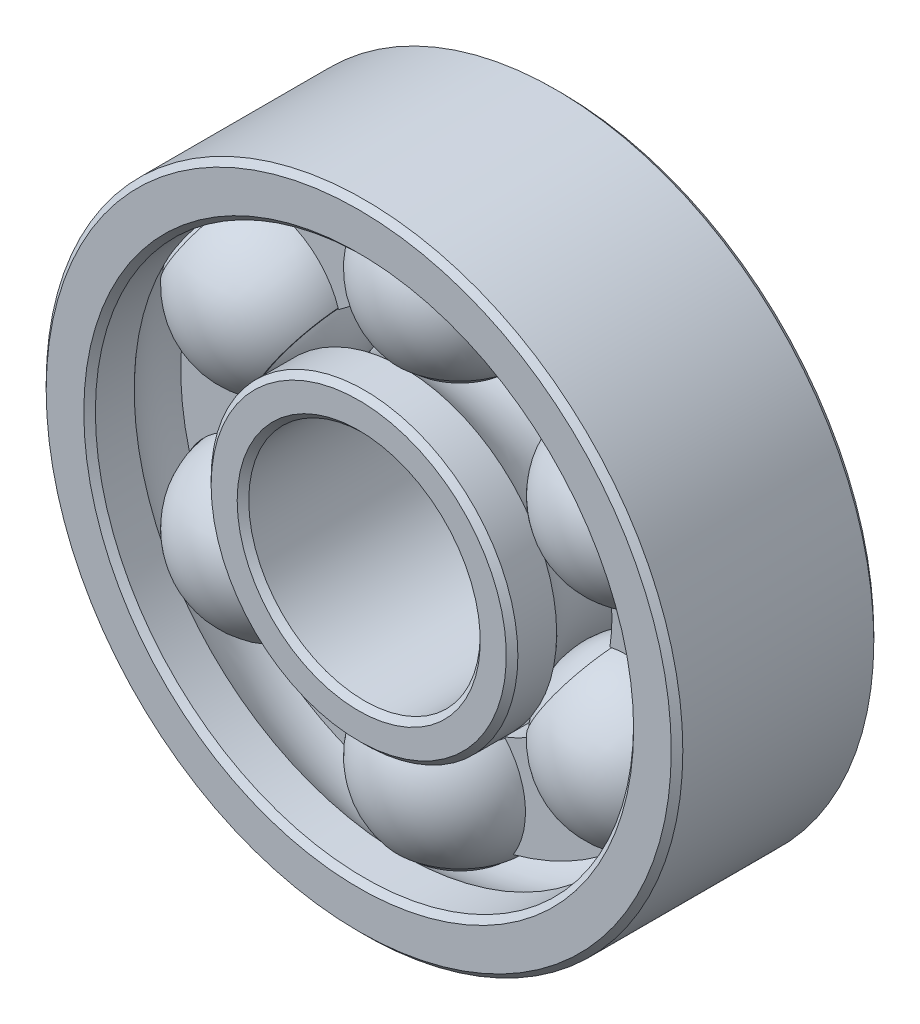
from build123d import *

# Parameters (mm, degrees)
CIRPATTERN1_COUNT = 6
CIRPATTERN2_COUNT = 6
EXTRUDE1_DEPTH    = 0.55
CIRPATTERN4_COUNT = 6
CHAMFER1_SIZE     = 0.2
CHAMFER_1_SIZE    = 0.2


with BuildPart() as part:
    # Sketch1 → Revolve1 (revolve)
    with BuildSketch(Plane(origin=(0, 0, 0), x_dir=(0, 0, -1), z_dir=(1, 0, 0))):
        with BuildLine():
            Line((-3.5, 11), (3.5, 11))
            Line((3.5, 11), (3.5, 9.3))
            Line((3.5, 9.3), (1.959591794, 9.3))
            ThreePointArc((1.959591794, 9.3), (0, 10.1), (-1.959591794, 9.3))
            Line((-1.959591794, 9.3), (-3.5, 9.3))
            Line((-3.5, 9.3), (-3.5, 11))
        make_face()
        with BuildLine():
            Line((-3.5, 5.3), (-1.959591794, 5.3))
            ThreePointArc((-1.959591794, 5.3), (0, 4.5), (1.959591794, 5.3))
            Line((1.959591794, 5.3), (3.5, 5.3))
            Line((3.5, 5.3), (3.5, 4))
            Line((3.5, 4), (-3.5, 4))
            Line((-3.5, 4), (-3.5, 5.3))
        make_face()
    revolve(axis=Axis((0, 0, 0), (0, 0, -1)))

    # Chamfer1
    chamfer1_edges = [part.edges().sort_by_distance(p)[0] for p in [
        (0, -4, -3.5),
        (0, -5.3, -3.5),
        (0, -5.3, 3.5),
        (0, -4, 3.5),
    ]]
    chamfer(chamfer1_edges, length=CHAMFER1_SIZE)

    # Фаска1
    chamfer_1_edges = [part.edges().sort_by_distance(p)[0] for p in [
        (0, -11, 3.5),
        (0, -9.3, 3.5),
        (0, -9.3, -3.5),
        (0, -11, -3.5),
    ]]
    chamfer(chamfer_1_edges, length=CHAMFER_1_SIZE)


with BuildPart() as body_2:
    # Sketch2 → Revolve2 (revolve)
    with BuildSketch(Plane(origin=(0, 0, 0), x_dir=(0, 0, -1), z_dir=(1, 0, 0))):
        with BuildLine():
            Line((0, 4.4873), (0, 10.1127))
            ThreePointArc((0, 10.1127), (2.8127, 7.3), (0, 4.4873))
        make_face()
    revolve(axis=Axis((0, 4.4873, 0), (0, 1, 0)))


with BuildPart() as cirpattern1_1:
    # CirPattern1: pattern copy
    add(body_2.part.rotate(Axis((0, 0, 0), (0, 0, 1)), 1 * 360 / CIRPATTERN1_COUNT))


with BuildPart() as cirpattern1_2:
    # CirPattern1: pattern copy
    add(body_2.part.rotate(Axis((0, 0, 0), (0, 0, 1)), 2 * 360 / CIRPATTERN1_COUNT))


with BuildPart() as cirpattern1_3:
    # CirPattern1: pattern copy
    add(body_2.part.rotate(Axis((0, 0, 0), (0, 0, 1)), 3 * 360 / CIRPATTERN1_COUNT))


with BuildPart() as cirpattern1_4:
    # CirPattern1: pattern copy
    add(body_2.part.rotate(Axis((0, 0, 0), (0, 0, 1)), 4 * 360 / CIRPATTERN1_COUNT))


with BuildPart() as cirpattern1_5:
    # CirPattern1: pattern copy
    add(body_2.part.rotate(Axis((0, 0, 0), (0, 0, 1)), 5 * 360 / CIRPATTERN1_COUNT))


with BuildPart() as body_8:
    # Sketch3 → Revolve3 (revolve)
    with BuildSketch(Plane(origin=(0, 0, 0), x_dir=(0, 0, -1), z_dir=(1, 0, 0))):
        with BuildLine():
            Line((2.167948339, 5.45), (1.52561463, 5.45))
            ThreePointArc((1.52561463, 5.45), (2.397915762, 7.3), (1.52561463, 9.15))
            Line((1.52561463, 9.15), (2.167948339, 9.15))
            ThreePointArc((2.167948339, 9.15), (2.85, 7.3), (2.167948339, 5.45))
        make_face()
    revolve(axis=Axis((0, 11, 0), (0, -1, 0)))


with BuildPart() as cirpattern2_1:
    # CirPattern2: pattern copy
    add(body_8.part.rotate(Axis((0, 0, 0), (0, 0, 1)), 1 * 360 / CIRPATTERN2_COUNT))


with BuildPart() as cirpattern2_2:
    # CirPattern2: pattern copy
    add(body_8.part.rotate(Axis((0, 0, 0), (0, 0, 1)), 2 * 360 / CIRPATTERN2_COUNT))


with BuildPart() as cirpattern2_3:
    # CirPattern2: pattern copy
    add(body_8.part.rotate(Axis((0, 0, 0), (0, 0, 1)), 3 * 360 / CIRPATTERN2_COUNT))


with BuildPart() as cirpattern2_4:
    # CirPattern2: pattern copy
    add(body_8.part.rotate(Axis((0, 0, 0), (0, 0, 1)), 4 * 360 / CIRPATTERN2_COUNT))


with BuildPart() as cirpattern2_5:
    # CirPattern2: pattern copy
    add(body_8.part.rotate(Axis((0, 0, 0), (0, 0, 1)), 5 * 360 / CIRPATTERN2_COUNT))


with BuildPart() as body_14:
    # Sketch5 → Extrude1 (new, symmetric)
    with BuildSketch(Plane.XY):
        with BuildLine():
            ThreePointArc((-2.391805924, 8.780049227), (-4.55, 7.880831174), (-6.407842715, 6.461389304))
            ThreePointArc((-6.407842715, 6.461389304), (-4.700512068, 5.948283135), (-3.644587573, 4.511871167))
            ThreePointArc((-3.644587573, 4.511871167), (-2.9, 5.022947342), (-2.085101263, 5.412241008))
            ThreePointArc((-2.085101263, 5.412241008), (-2.80110827, 7.044904429), (-2.391805924, 8.780049227))
        make_face()
    extrude(amount=EXTRUDE1_DEPTH, both=True)


with BuildPart() as cirpattern4_1:
    # CirPattern4: pattern copy
    add(body_14.part.rotate(Axis((0, 0, 0), (0, 0, -1)), 1 * 360 / CIRPATTERN4_COUNT))


with BuildPart() as cirpattern4_2:
    # CirPattern4: pattern copy
    add(body_14.part.rotate(Axis((0, 0, 0), (0, 0, -1)), 2 * 360 / CIRPATTERN4_COUNT))


with BuildPart() as cirpattern4_3:
    # CirPattern4: pattern copy
    add(body_14.part.rotate(Axis((0, 0, 0), (0, 0, -1)), 3 * 360 / CIRPATTERN4_COUNT))


with BuildPart() as cirpattern4_4:
    # CirPattern4: pattern copy
    add(body_14.part.rotate(Axis((0, 0, 0), (0, 0, -1)), 4 * 360 / CIRPATTERN4_COUNT))


with BuildPart() as cirpattern4_5:
    # CirPattern4: pattern copy
    add(body_14.part.rotate(Axis((0, 0, 0), (0, 0, -1)), 5 * 360 / CIRPATTERN4_COUNT))


solid = Compound([part.part, body_2.part, cirpattern1_1.part, cirpattern1_2.part, cirpattern1_3.part, cirpattern1_4.part, cirpattern1_5.part, body_8.part, cirpattern2_1.part, cirpattern2_2.part, cirpattern2_3.part, cirpattern2_4.part, cirpattern2_5.part, body_14.part, cirpattern4_1.part, cirpattern4_2.part, cirpattern4_3.part, cirpattern4_4.part, cirpattern4_5.part])
